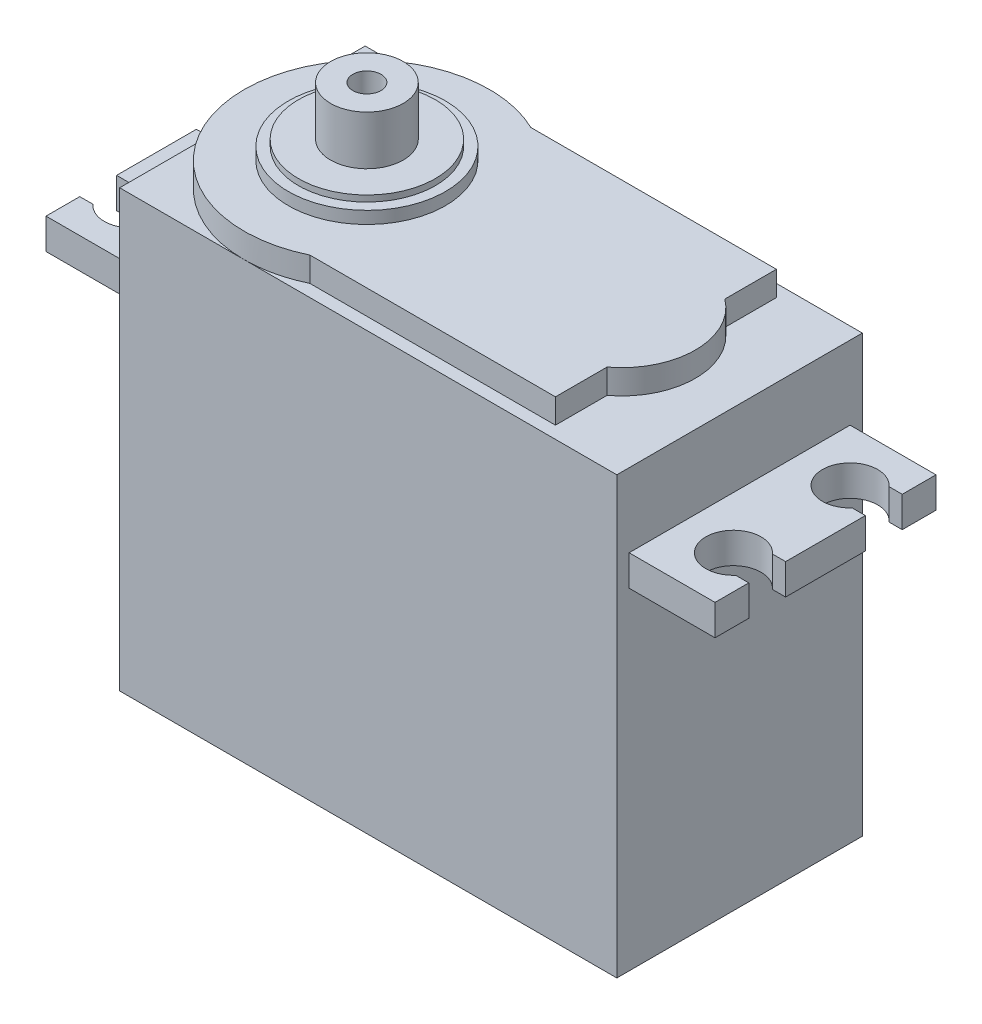
from build123d import *

# Parameters (mm, degrees)
ESBO_O1_W                = 40.5
ESBO_O1_H                = 35.5
RESSALTO_EXTRUS_O1_DEPTH = 20
RESSALTO_EXTRUS_O2_DEPTH = 2
ESBO_O3_W                = 18
ESBO_O3_H                = 2.499999999
RESSALTO_EXTRUS_O3_DEPTH = 7
CORTE_EXTRUS_O1_DEPTH    = 40.642937579
CORTE_EXTRUS_O2_DEPTH    = 40.642937579
RESSALTO_EXTRUS_O4_DEPTH = 2
ESBO_O7_W                = 18
ESBO_O7_H                = 2.499999994
RESSALTO_EXTRUS_O5_DEPTH = 7
CORTE_EXTRUS_O3_DEPTH    = 42.386138978
CORTE_EXTRUS_O4_DEPTH    = 42.386138978
ESBO_O10_W               = 2.25
ESBO_O10_H               = 2.5
ESBO_O11_W               = 2.25
ESBO_O11_H               = 2.5
ESBO_O12_W               = 2.25
ESBO_O12_H               = 2.5
ESBO_O13_W               = 2.25
ESBO_O13_H               = 2.5
ESBO_O15_R               = 2.96
ESBO_O15_R_2             = 1.15
RESSALTO_EXTRUS_O6_DEPTH = 4


with BuildPart() as part:
    # Esboço1 → Ressalto-extrusão1 (new body)
    with BuildSketch(Plane(origin=(0, 0, -10), x_dir=(-1, 0, 0), z_dir=(0, 0, -1))):
        with Locations((0, 17.75)):
            Rectangle(ESBO_O1_W, ESBO_O1_H)
    extrude(amount=-RESSALTO_EXTRUS_O1_DEPTH)

    # Esboço2 → Ressalto-extrusão2 (add)
    with BuildSketch(Plane(origin=(0, 35.5, 0), x_dir=(-1, 0, 0), z_dir=(0, 1, 0))):
        with BuildLine():
            Line((-14.25, 9), (5.75, 9))
            ThreePointArc((5.75, 9), (20.108898944, -1e-09), (5.75, -9))
            Line((5.75, -9), (-14.25, -9))
            Line((-14.25, -9), (-14.25, 9))
        make_face()
    extrude(amount=RESSALTO_EXTRUS_O2_DEPTH)

    # Esboço3 → Ressalto-extrusão3 (add)
    with BuildSketch(Plane(origin=(20.25, 0, 0), x_dir=(0, 0, -1), z_dir=(1, 0, 0))):
        with Locations((0, 28.249999997)):
            Rectangle(ESBO_O3_W, ESBO_O3_H)
    extrude(amount=RESSALTO_EXTRUS_O3_DEPTH)

    # Esboço4 → Corte-extrusão1 (cut, through all)
    with BuildSketch(Plane.XZ.offset(-26.999999997)):
        with BuildLine():
            Line((27.25, 3.25), (27.25, 6.25))
            Line((27.25, 6.25), (26.177050983, 6.25))
            ThreePointArc((26.177050983, 6.25), (26.75, 4.75), (26.177050983, 3.25))
            Line((26.177050983, 3.25), (27.25, 3.25))
        make_face()
    extrude(amount=-CORTE_EXTRUS_O1_DEPTH, mode=Mode.SUBTRACT)

    # Esboço5 → Corte-extrusão2 (cut, through all)
    with BuildSketch(Plane.XZ.offset(-26.999999997)):
        with BuildLine():
            Line((27.25, -6.25), (27.25, -3.25))
            Line((27.25, -3.25), (26.177050983, -3.25))
            ThreePointArc((26.177050983, -3.25), (26.75, -4.75), (26.177050983, -6.25))
            Line((26.177050983, -6.25), (27.25, -6.25))
        make_face()
    extrude(amount=-CORTE_EXTRUS_O2_DEPTH, mode=Mode.SUBTRACT)

    # Esboço6 → Ressalto-extrusão4 (add)
    with BuildSketch(Plane(origin=(0, 35.5, 0), x_dir=(-1, 0, 0), z_dir=(0, 1, 0))):
        with BuildLine():
            Line((-14.249999993, 4.8), (-14.249999993, -4.800000003))
            ThreePointArc((-14.249999993, -4.800000003), (-16.649999996, -1e-09), (-14.249999993, 4.8))
        make_face()
    extrude(amount=RESSALTO_EXTRUS_O4_DEPTH)

    # Esboço7 → Ressalto-extrusão5 (add)
    with BuildSketch(Plane.ZY.offset(20.25)):
        with Locations((0, 28.249999994)):
            Rectangle(ESBO_O7_W, ESBO_O7_H)
    extrude(amount=RESSALTO_EXTRUS_O5_DEPTH)

    # Esboço8 → Corte-extrusão3 (cut, through all)
    with BuildSketch(Plane(origin=(0, 29.499999991, 0), x_dir=(-1, 0, 0), z_dir=(0, 1, 0))):
        with BuildLine():
            Line((27.25, 6.25), (26.177050983, 6.25))
            ThreePointArc((26.177050983, 6.25), (26.75, 4.75), (26.177050983, 3.25))
            Line((26.177050983, 3.25), (27.25, 3.25))
            Line((27.25, 3.25), (27.25, 6.25))
        make_face()
    extrude(amount=-CORTE_EXTRUS_O3_DEPTH, mode=Mode.SUBTRACT)

    # Esboço9 → Corte-extrusão4 (cut, through all)
    with BuildSketch(Plane(origin=(0, 29.499999991, 0), x_dir=(-1, 0, 0), z_dir=(0, 1, 0))):
        with BuildLine():
            Line((27.25, -6.25), (27.25, -3.25))
            Line((27.25, -3.25), (26.177050983, -3.25))
            ThreePointArc((26.177050983, -3.25), (26.75, -4.75), (26.177050983, -6.25))
            Line((26.177050983, -6.25), (27.25, -6.25))
        make_face()
    extrude(amount=-CORTE_EXTRUS_O4_DEPTH, mode=Mode.SUBTRACT)

    # Esboço10 → Corte-Revolução1 (revolve, cut)
    with BuildSketch(Plane.XY.offset(4.75)):
        with Locations((-23.375, 28.25)):
            Rectangle(ESBO_O10_W, ESBO_O10_H)
    revolve(axis=Axis((-24.5, 29.5, 4.75), (0, -1, 0)), mode=Mode.SUBTRACT)

    # Esboço11 → Corte-Revolução2 (revolve, cut)
    with BuildSketch(Plane.XY.offset(-4.75)):
        with Locations((-23.375, 28.25)):
            Rectangle(ESBO_O11_W, ESBO_O11_H)
    revolve(axis=Axis((-24.5, 29.5, -4.75), (0, -1, 0)), mode=Mode.SUBTRACT)

    # Esboço12 → Corte-Revolução3 (revolve, cut)
    with BuildSketch(Plane.XY.offset(-4.75)):
        with Locations((25.625, 28.25)):
            Rectangle(ESBO_O12_W, ESBO_O12_H)
    revolve(axis=Axis((24.5, 29.5, -4.75), (0, -1, 0)), mode=Mode.SUBTRACT)

    # Esboço13 → Corte-Revolução4 (revolve, cut)
    with BuildSketch(Plane.XY.offset(4.75)):
        with Locations((25.625, 28.25)):
            Rectangle(ESBO_O13_W, ESBO_O13_H)
    revolve(axis=Axis((24.5, 29.5, 4.75), (0, -1, 0)), mode=Mode.SUBTRACT)

    # Esboço14 → Revolução1 (revolve)
    with BuildSketch(Plane.XY, mode=Mode.PRIVATE) as revolu_o1_sk:
        Polygon((-4.533898944, 39), (-10.108898944, 39), (-10.108898944, 37.5), (-3.708898944, 37.5), (-3.708898944, 38.5), (-4.533898944, 38.5), align=None)
    revolve(revolu_o1_sk.sketch.rotate(Axis((-10.108898944, 39, 0), (0, -1, 0)), 270), axis=Axis((-10.108898944, 39, 0), (0, -1, 0)))

    # Esboço15 → Ressalto-extrusão6 (add)
    with BuildSketch(Plane(origin=(0, 39, 0), x_dir=(1, 0, 0), z_dir=(0, 1, 0))):
        with Locations(Location((-10.108898944, 0, 0), (0, 0, 270))):
            Circle(ESBO_O15_R)
        with Locations(Location((-10.108898944, 0, 0), (0, 0, 270))):
            Circle(ESBO_O15_R_2, mode=Mode.SUBTRACT)
    extrude(amount=RESSALTO_EXTRUS_O6_DEPTH)


solid = part.part
